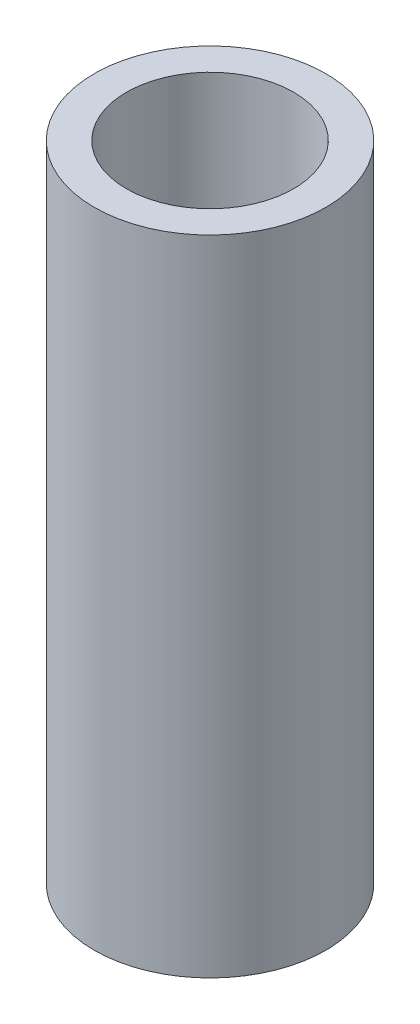
from build123d import *

# Parameters (mm, degrees)
SKETCH_1_R      = 4.5
SKETCH_1_R_2    = 3.25
EXTRUDE_1_DEPTH = 25


with BuildPart() as part:
    # 草圖1 → 填料-伸長1 (new body)
    with BuildSketch(Plane(origin=(0, 0, 0), x_dir=(1, 0, 0), z_dir=(0, 1, 0))):
        with Locations(Location((0, 0, 0), (0, 0, 270))):
            Circle(SKETCH_1_R)
        with Locations(Location((0, 0, 0), (0, 0, 270))):
            Circle(SKETCH_1_R_2, mode=Mode.SUBTRACT)
    extrude(amount=EXTRUDE_1_DEPTH)


solid = part.part
